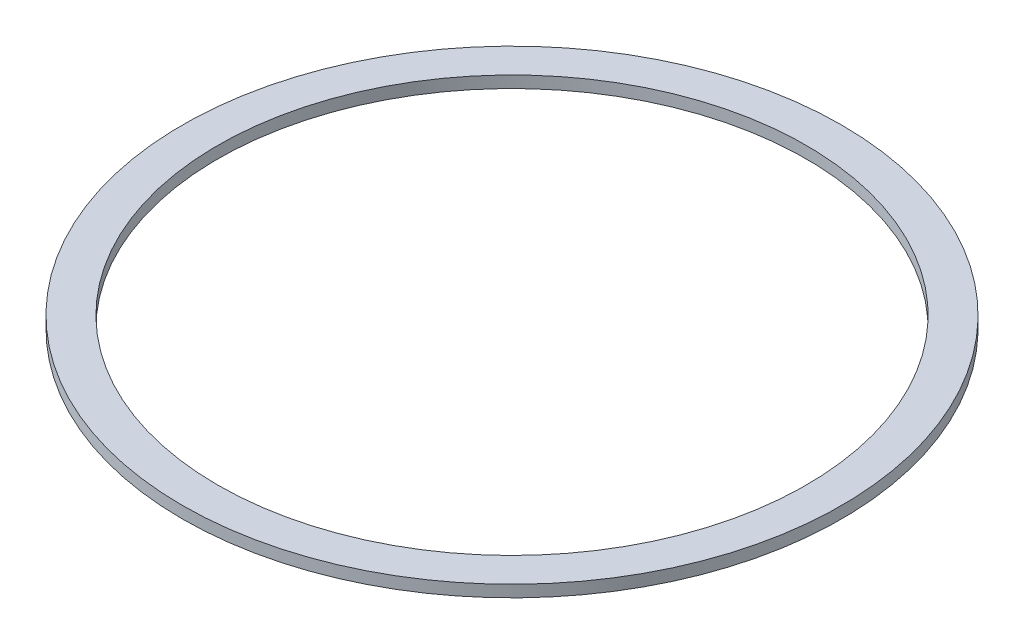
from build123d import *

# Parameters (mm, degrees)
SKETCH_1_R      = 28
SKETCH_1_R_2    = 25
EXTRUDE_1_DEPTH = 1


with BuildPart() as part:
    # 草图1 → 凸台-拉伸1 (new body)
    with BuildSketch(Plane(origin=(0, 0, 0), x_dir=(1, 0, 0), z_dir=(0, 1, 0))):
        with Locations(Location((0, 0, 0), (0, 0, 270))):
            Circle(SKETCH_1_R)
        with Locations(Location((0, 0, 0), (0, 0, 270))):
            Circle(SKETCH_1_R_2, mode=Mode.SUBTRACT)
    extrude(amount=EXTRUDE_1_DEPTH)


solid = part.part
